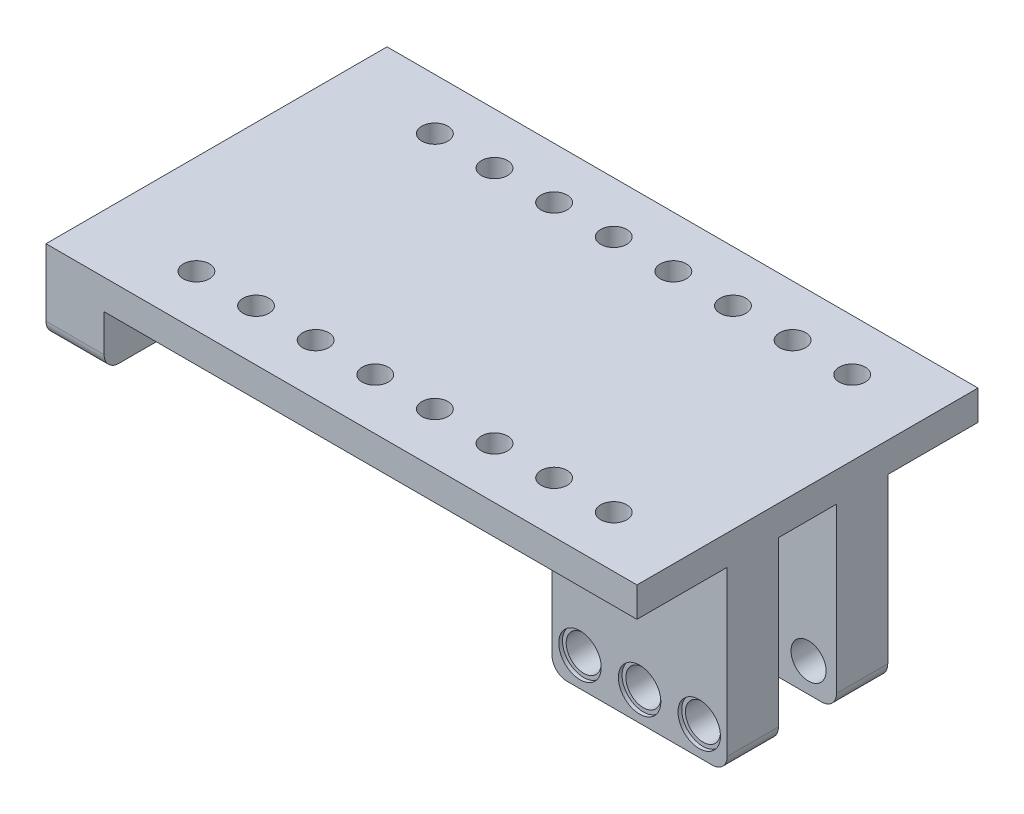
from build123d import *

# Parameters (mm, degrees)
SKETCH_1_W          = 79.3
SKETCH_1_H          = 45.76
EXTRUDE_1_DEPTH     = 4
SKETCH_2_W          = 7.8
SKETCH_2_H          = 45.76
EXTRUDE_2_DEPTH     = 7
CUT_EXTRUDE_1_REACH = 84.831
SKETCH_3_R          = 2.35
SKETCH_4_R          = 2.85
CUT_EXTRUDE_2_DEPTH = 0.5
CUT_EXTRUDE_START   = -0.5
SKETCH_5_R          = 2.85
CUT_EXTRUDE_3_DEPTH = 0.5
SKETCH_6_W          = 23.51189996
SKETCH_6_H          = 6.871263118
EXTRUDE_4_DEPTH     = 24
SKETCH_7_R          = 2.35
CUT_EXTRUDE_4_DEPTH = 58.27591125
SKETCH_8_R          = 2.85
CUT_EXTRUDE_5_DEPTH = 0.5
SKETCH_9_R          = 2.85
CUT_EXTRUDE_6_DEPTH = 0.5
FILLET_1_R          = 2
FILLET_2_R          = 2
FILLET_3_R          = 2
SKETCH_10_R         = 1.75
CUT_EXTRUDE_7_DEPTH = 4


with BuildPart() as part:
    # Эскиз1 → Бобышка-Вытянуть1 (new body)
    with BuildSketch(Plane(origin=(0, 0, 0), x_dir=(1, 0, 0), z_dir=(0, 1, 0))):
        Rectangle(SKETCH_1_W, SKETCH_1_H)
    extrude(amount=EXTRUDE_1_DEPTH)

    # Эскиз2 → Бобышка-Вытянуть2 (add)
    with BuildSketch(Plane.XZ):
        with Locations((-35.75, 0)):
            Rectangle(SKETCH_2_W, SKETCH_2_H)
    extrude(amount=EXTRUDE_2_DEPTH)

    # Эскиз3 → Вырез-Вытянуть1 (cut, up to next)
    with BuildSketch(Plane.ZY.offset(39.65), mode=Mode.PRIVATE) as cut_extrude_1_sk1:
        with Locations((0, -3.5)):
            Circle(SKETCH_3_R)
    cut_extrude_1_tool1 = extrude(cut_extrude_1_sk1.sketch, amount=-CUT_EXTRUDE_1_REACH, mode=Mode.PRIVATE) & part.part
    # Эскиз3 → Вырез-Вытянуть1 (cut, up to next)
    with BuildSketch(Plane.ZY.offset(39.65), mode=Mode.PRIVATE) as cut_extrude_1_sk2:
        with Locations((-8, -3.5)):
            Circle(SKETCH_3_R)
    cut_extrude_1_tool2 = extrude(cut_extrude_1_sk2.sketch, amount=-CUT_EXTRUDE_1_REACH, mode=Mode.PRIVATE) & part.part
    # Эскиз3 → Вырез-Вытянуть1 (cut, up to next)
    with BuildSketch(Plane.ZY.offset(39.65), mode=Mode.PRIVATE) as cut_extrude_1_sk3:
        with Locations((8, -3.5)):
            Circle(SKETCH_3_R)
    cut_extrude_1_tool3 = extrude(cut_extrude_1_sk3.sketch, amount=-CUT_EXTRUDE_1_REACH, mode=Mode.PRIVATE) & part.part
    add(cut_extrude_1_tool1.solids().sort_by_distance((-39.65, -3.5, 0))[0], mode=Mode.SUBTRACT)
    add(cut_extrude_1_tool2.solids().sort_by_distance((-39.65, -3.5, -8))[0], mode=Mode.SUBTRACT)
    add(cut_extrude_1_tool3.solids().sort_by_distance((-39.65, -3.5, 8))[0], mode=Mode.SUBTRACT)

    # Эскиз4 → Вырез-Вытянуть2 (cut)
    with BuildSketch(Plane.ZY.offset(39.65)):
        with Locations((-8, -3.5)):
            Circle(SKETCH_4_R)
        with Locations((0, -3.5)):
            Circle(SKETCH_4_R)
        with Locations((8, -3.5)):
            Circle(SKETCH_4_R)
    extrude(amount=-CUT_EXTRUDE_2_DEPTH, mode=Mode.SUBTRACT)

    # Эскиз5 → Вырез-Вытянуть3 (cut)
    with BuildSketch(Plane(origin=(-31.85, 0, 0), x_dir=(0, 0, -1), z_dir=(1, 0, 0)).offset(CUT_EXTRUDE_START)):
        with Locations(Location((-8, -3.5, 0), (0, 0, 180))):
            Circle(SKETCH_5_R)
        with Locations(Location((0, -3.5, 0), (0, 0, 180))):
            Circle(SKETCH_5_R)
        with Locations(Location((8, -3.5, 0), (0, 0, 180))):
            Circle(SKETCH_5_R)
    extrude(amount=CUT_EXTRUDE_3_DEPTH, mode=Mode.SUBTRACT)

    # Эскиз6 → Бобышка-Вытянуть4 (add)
    with BuildSketch(Plane.XZ):
        with Locations((27.89405002, 7.335631559)):
            Rectangle(SKETCH_6_W, SKETCH_6_H)
        with Locations((27.89405002, -7.335631559)):
            Rectangle(SKETCH_6_W, SKETCH_6_H)
    extrude(amount=EXTRUDE_4_DEPTH)

    # Эскиз7 → Вырез-Вытянуть4 (cut, through all)
    with BuildSketch(Plane(origin=(0, 0, -10.771263118), x_dir=(-1, 0, 0), z_dir=(0, 0, -1))):
        with Locations((-27.89405002, -20.1)):
            Circle(SKETCH_7_R)
        with Locations((-19.89405002, -20.1)):
            Circle(SKETCH_7_R)
        with Locations((-35.89405002, -20.1)):
            Circle(SKETCH_7_R)
    extrude(amount=-CUT_EXTRUDE_4_DEPTH, mode=Mode.SUBTRACT)

    # Эскиз8 → Вырез-Вытянуть5 (cut)
    with BuildSketch(Plane.XY.offset(10.771263118)):
        with Locations((19.89405002, -20.1)):
            Circle(SKETCH_8_R)
        with Locations((27.89405002, -20.1)):
            Circle(SKETCH_8_R)
        with Locations((35.89405002, -20.1)):
            Circle(SKETCH_8_R)
    extrude(amount=-CUT_EXTRUDE_5_DEPTH, mode=Mode.SUBTRACT)

    # Эскиз9 → Вырез-Вытянуть6 (cut)
    with BuildSketch(Plane(origin=(0, 0, -10.771263118), x_dir=(-1, 0, 0), z_dir=(0, 0, -1)).offset(CUT_EXTRUDE_START)):
        with Locations(Location((-35.89405002, -20.1, 0), (0, 0, 180))):
            Circle(SKETCH_9_R)
        with Locations(Location((-27.89405002, -20.1, 0), (0, 0, 180))):
            Circle(SKETCH_9_R)
        with Locations(Location((-19.89405002, -20.1, 0), (0, 0, 180))):
            Circle(SKETCH_9_R)
    extrude(amount=CUT_EXTRUDE_6_DEPTH, mode=Mode.SUBTRACT)

    # Скругление1
    fillet_1_edges = [part.edges().sort_by_distance(p)[0] for p in [
        (16.13810004, -24, -7.335631559),
        (39.65, -24, -7.335631559),
    ]]
    fillet(fillet_1_edges, radius=FILLET_1_R)

    # Скругление2
    fillet_2_edges = [part.edges().sort_by_distance(p)[0] for p in [
        (39.65, -24, 7.335631559),
        (16.13810004, -24, 7.335631559),
    ]]
    fillet(fillet_2_edges, radius=FILLET_2_R)

    # Скругление3
    fillet_3_edges = [part.edges().sort_by_distance(p)[0] for p in [
        (-35.75, -7, -22.88),
        (-35.75, -7, 22.88),
    ]]
    fillet(fillet_3_edges, radius=FILLET_3_R)

    # Эскиз10 → Вырез-Вытянуть7 (cut)
    with BuildSketch(Plane(origin=(0, 4, 0), x_dir=(1, 0, 0), z_dir=(0, 1, 0))):
        with Locations(Location((29.65, 16, 0), (0, 0, 270))):
            Circle(SKETCH_10_R)
        with Locations(Location((29.65, -16, 0), (0, 0, 270))):
            Circle(SKETCH_10_R)
        with Locations(Location((21.65, 16, 0), (0, 0, 270))):
            Circle(SKETCH_10_R)
        with Locations(Location((21.65, -16, 0), (0, 0, 270))):
            Circle(SKETCH_10_R)
        with Locations(Location((13.65, 16, 0), (0, 0, 270))):
            Circle(SKETCH_10_R)
        with Locations(Location((13.65, -16, 0), (0, 0, 270))):
            Circle(SKETCH_10_R)
        with Locations(Location((5.65, 16, 0), (0, 0, 270))):
            Circle(SKETCH_10_R)
        with Locations(Location((5.65, -16, 0), (0, 0, 270))):
            Circle(SKETCH_10_R)
        with Locations(Location((-2.35, 16, 0), (0, 0, 270))):
            Circle(SKETCH_10_R)
        with Locations(Location((-2.35, -16, 0), (0, 0, 270))):
            Circle(SKETCH_10_R)
        with Locations(Location((-10.35, 16, 0), (0, 0, 270))):
            Circle(SKETCH_10_R)
        with Locations(Location((-10.35, -16, 0), (0, 0, 270))):
            Circle(SKETCH_10_R)
        with Locations(Location((-18.35, 16, 0), (0, 0, 270))):
            Circle(SKETCH_10_R)
        with Locations(Location((-18.35, -16, 0), (0, 0, 270))):
            Circle(SKETCH_10_R)
        with Locations(Location((-26.35, 16, 0), (0, 0, 270))):
            Circle(SKETCH_10_R)
        with Locations(Location((-26.35, -16, 0), (0, 0, 270))):
            Circle(SKETCH_10_R)
    extrude(amount=-CUT_EXTRUDE_7_DEPTH, mode=Mode.SUBTRACT)


solid = part.part
